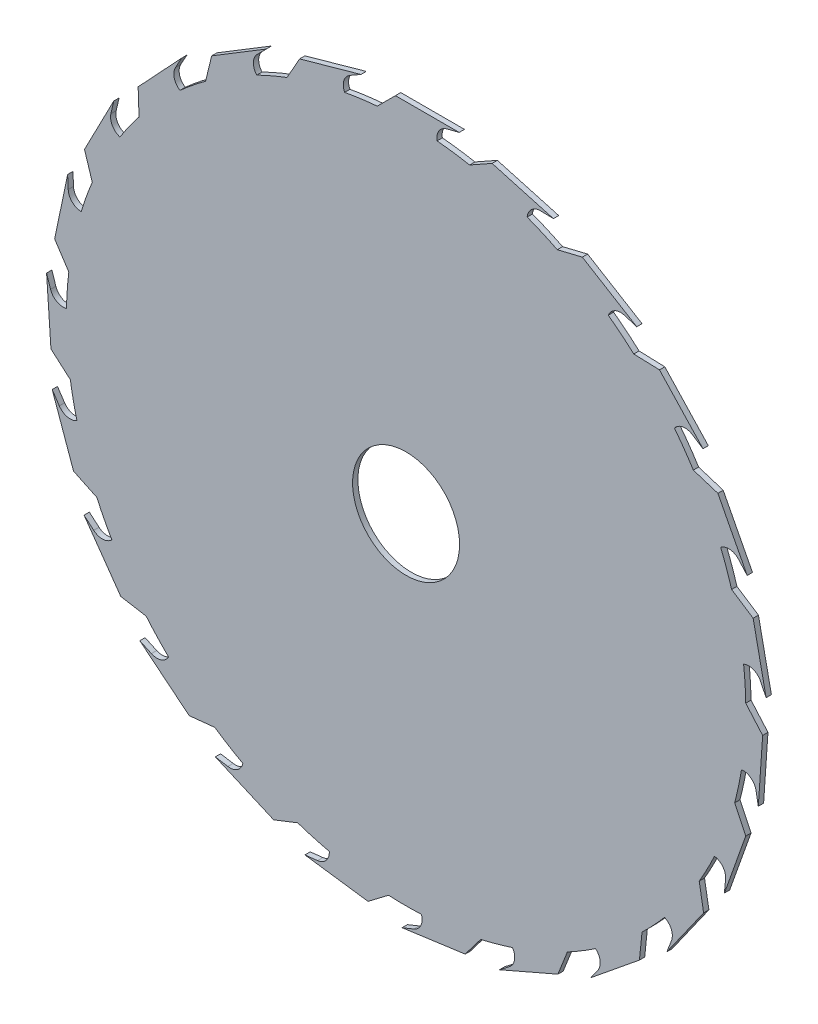
from build123d import *

# Parameters (mm, degrees)
SKETCH1_R           = 101.6
BOSS_EXTRUDE1_DEPTH = 1.5875
CUT_EXTRUDE1_REACH  = 145.693
SKETCH2_R           = 16.002
BOSS_EXTRUDE2_DEPTH = 1.5875
CIRPATTERN1_COUNT   = 23


with BuildPart() as part:
    # Sketch1 → Boss-Extrude1 (new body)
    with BuildSketch(Plane.XY):
        Circle(SKETCH1_R)
    extrude(amount=BOSS_EXTRUDE1_DEPTH)

    # Sketch2 → Cut-Extrude1 (cut, up to next)
    with BuildSketch(Plane.XY.offset(1.5875), mode=Mode.PRIVATE) as cut_extrude1_sk1:
        Circle(SKETCH2_R)
    cut_extrude1_tool1 = extrude(cut_extrude1_sk1.sketch, amount=-CUT_EXTRUDE1_REACH, mode=Mode.PRIVATE) & part.part
    add(cut_extrude1_tool1.solids().sort_by_distance((0, 0, 1.5875))[0], mode=Mode.SUBTRACT)

    # Sketch4 → Boss-Extrude2 (add)
    with BuildSketch(Plane.XY.offset(1.5875)):
        with BuildLine():
            Line((-9.525, 100.33), (-3.175, 106.68))
            Line((-3.175, 106.68), (15.875, 106.68))
            Line((15.875, 106.68), (12.1812879, 105.745874246))
            ThreePointArc((12.1812879, 105.745874246), (9.599565558, 103.652771398), (9.525, 100.33))
            Line((9.525, 100.33), (-9.525, 100.33))
        make_face()
    boss_extrude2 = extrude(amount=-BOSS_EXTRUDE2_DEPTH)

    # CirPattern1: Boss-Extrude2 ×23 about axis
    cirpattern1_axis = Axis((0, 0, 0), (0, 0, 1))
    for i in range(1, CIRPATTERN1_COUNT):
        add(boss_extrude2.rotate(cirpattern1_axis, i * 360 / CIRPATTERN1_COUNT))


solid = part.part
